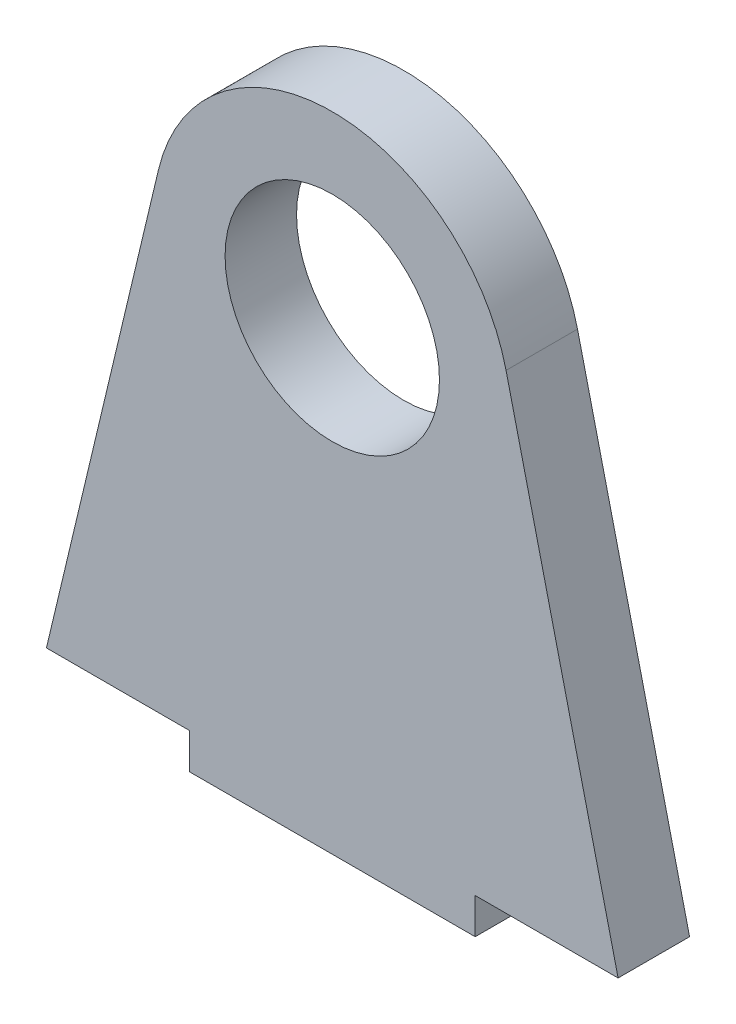
from build123d import *

# Parameters (mm, degrees)
SKETCH1_R           = 7.5
BOSS_EXTRUDE1_DEPTH = 5


with BuildPart() as part:
    # Sketch1 → Boss-Extrude1 (new body)
    with BuildSketch(Plane.XY):
        with BuildLine():
            Line((12.159434561, 19.147956374), (20, -13.75))
            Line((20, -13.75), (10, -13.75))
            Line((10, -13.75), (10, -16.25))
            Line((10, -16.25), (-10, -16.25))
            Line((-10, -16.25), (-10, -13.75))
            Line((-10, -13.75), (-20, -13.75))
            Line((-20, -13.75), (-12.159434561, 19.147956374))
            ThreePointArc((-12.159434561, 19.147956374), (0, 28.75), (12.159434561, 19.147956374))
        make_face()
        with Locations((0, 16.25)):
            Circle(SKETCH1_R, mode=Mode.SUBTRACT)
    extrude(amount=BOSS_EXTRUDE1_DEPTH)


solid = part.part
